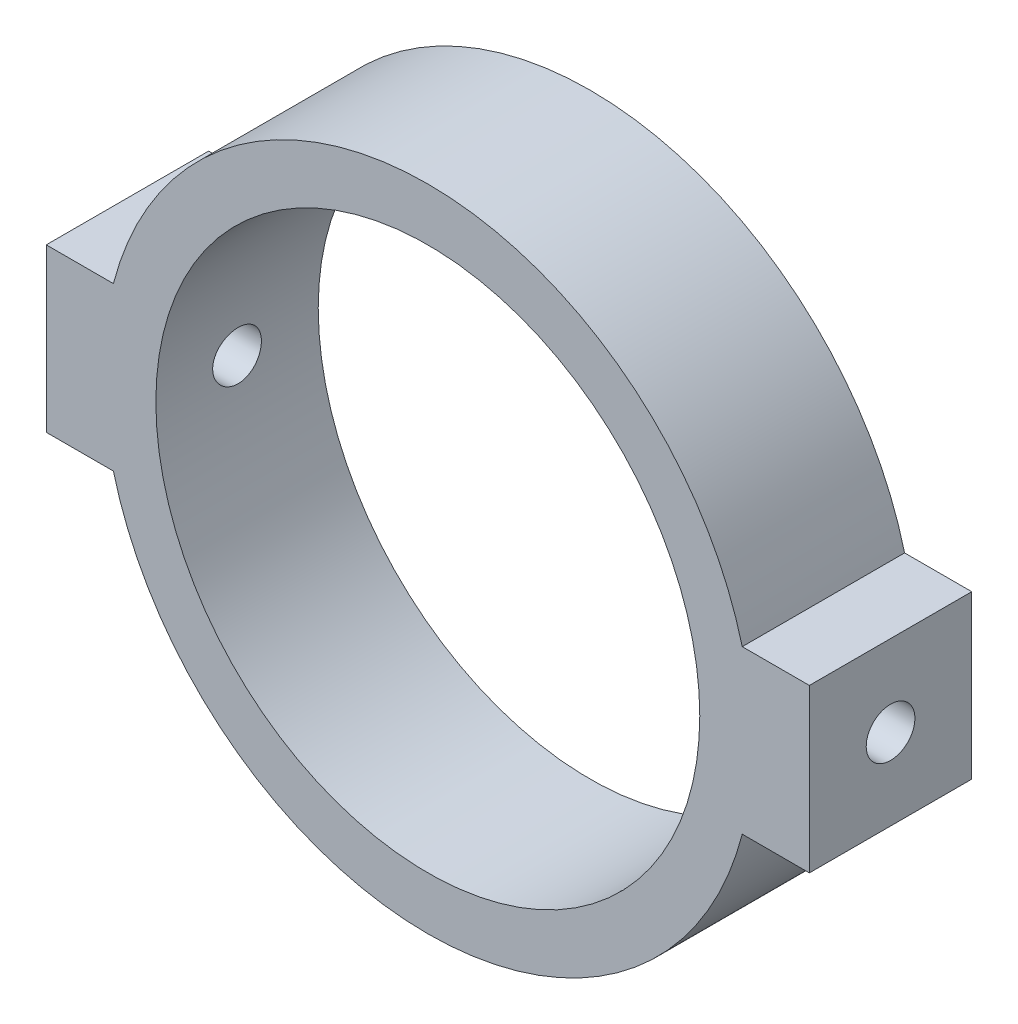
from build123d import *

# Parameters (mm, degrees)
CROQUIS1_R              = 16.75
SALIENTE_EXTRUIR1_DEPTH = 10
CROQUIS2_R              = 1.5
CORTAR_EXTRUIR1_DEPTH   = 67


with BuildPart() as part:
    # Croquis1 → Saliente-Extruir1 (new body)
    with BuildSketch(Plane.XY):
        with BuildLine():
            Line((-23.5, -5), (-19.364916731, -5))
            ThreePointArc((-19.364916731, -5), (0, -20), (19.364916731, -5))
            Line((19.364916731, -5), (23.5, -5))
            Line((23.5, -5), (23.5, 5))
            Line((23.5, 5), (19.364916731, 5))
            ThreePointArc((19.364916731, 5), (0, 20), (-19.364916731, 5))
            Line((-19.364916731, 5), (-23.5, 5))
            Line((-23.5, 5), (-23.5, -5))
        make_face()
        Circle(CROQUIS1_R, mode=Mode.SUBTRACT)
    extrude(amount=SALIENTE_EXTRUIR1_DEPTH)

    # Croquis2 → Cortar-Extruir1 (cut)
    with BuildSketch(Plane(origin=(23.5, 0, 0), x_dir=(0, 0, -1), z_dir=(1, 0, 0))):
        with Locations(Location((-5, 0, 0), (0, 0, 90))):
            Circle(CROQUIS2_R)
    extrude(amount=-CORTAR_EXTRUIR1_DEPTH, mode=Mode.SUBTRACT)


solid = part.part
